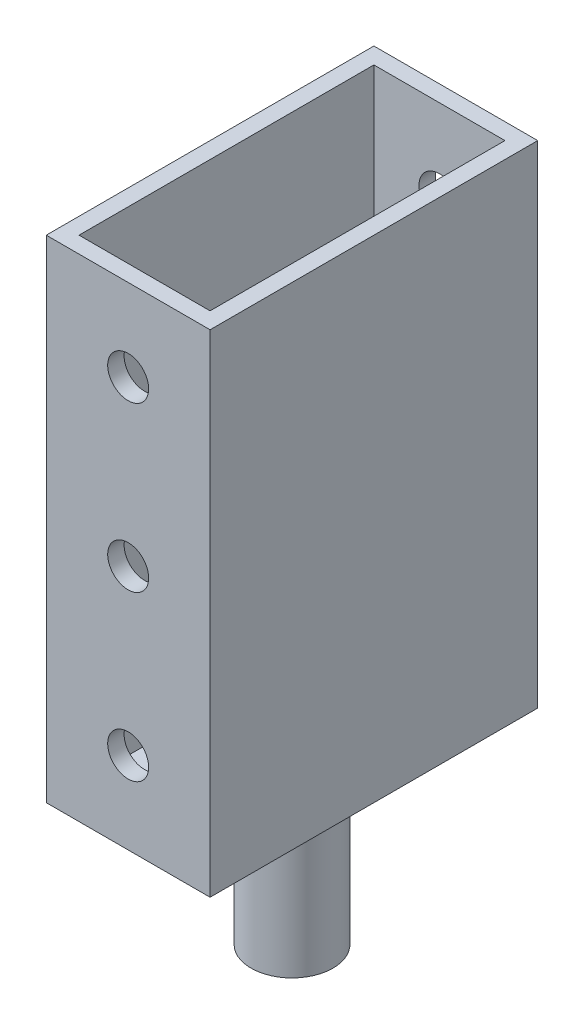
from build123d import *

# Parameters (mm, degrees)
SKETCH1_W           = 25.4
SKETCH1_H           = 76.2
BOSS_EXTRUDE1_DEPTH = 25.4
SKETCH2_R           = 3.175
CUT_EXTRUDE1_DEPTH  = 96.038097624
SKETCH3_W           = 20.32
SKETCH3_H           = 45.72
CUT_EXTRUDE2_DEPTH  = 73.66
SKETCH4_R           = 6.35
BOSS_EXTRUDE2_DEPTH = 25.4


with BuildPart() as part:
    # Sketch1 → Boss-Extrude1 (new, symmetric)
    with BuildSketch(Plane.XY):
        with Locations((12.7, 38.1)):
            Rectangle(SKETCH1_W, SKETCH1_H)
    extrude(amount=BOSS_EXTRUDE1_DEPTH, both=True)

    # Sketch2 → Cut-Extrude1 (cut, through all)
    with BuildSketch(Plane.XY.offset(25.4)):
        with Locations((12.7, 38.1)):
            Circle(SKETCH2_R)
        with Locations((12.7, 63.5)):
            Circle(SKETCH2_R)
        with Locations((12.7, 88.9)):
            Circle(SKETCH2_R)
        with Locations((12.7, 12.7)):
            Circle(SKETCH2_R)
    extrude(amount=-CUT_EXTRUDE1_DEPTH, mode=Mode.SUBTRACT)

    # Sketch3 → Cut-Extrude2 (cut)
    with BuildSketch(Plane(origin=(0, 76.2, 0), x_dir=(1, 0, 0), z_dir=(0, 1, 0))):
        with Locations((12.7, 0)):
            Rectangle(SKETCH3_W, SKETCH3_H)
    extrude(amount=-CUT_EXTRUDE2_DEPTH, mode=Mode.SUBTRACT)

    # Sketch4 → Boss-Extrude2 (add)
    with BuildSketch(Plane.XZ):
        with Locations(Location((12.7, 0, 0), (0, 0, 270))):
            Circle(SKETCH4_R)
    extrude(amount=BOSS_EXTRUDE2_DEPTH)


solid = part.part
